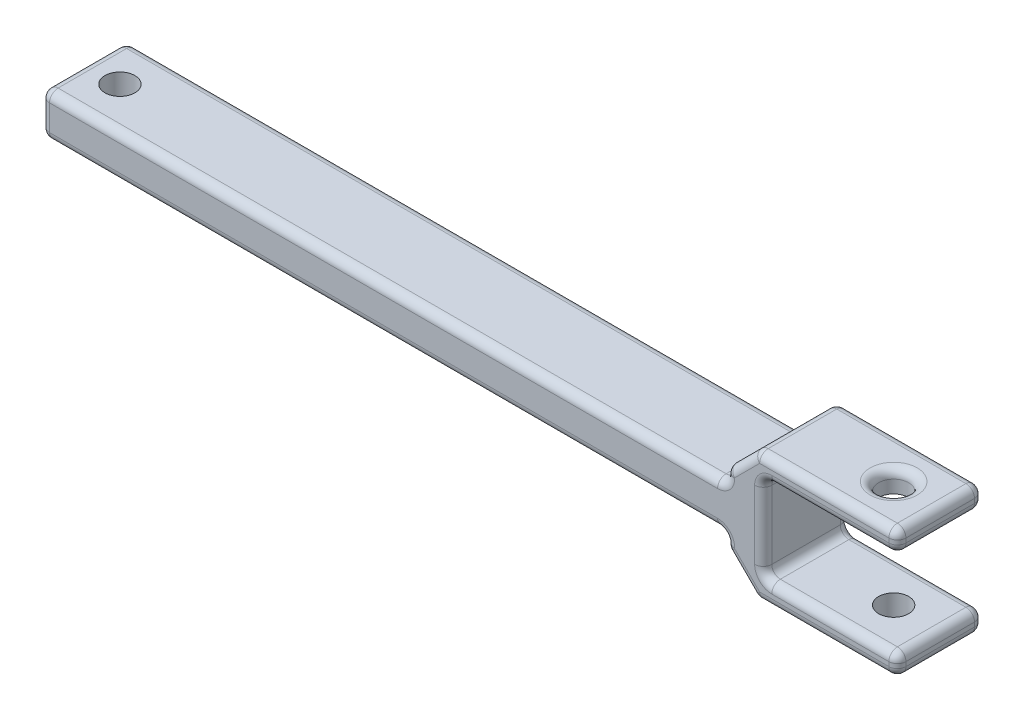
from build123d import *

# Parameters (mm, degrees)
BOSS_EXTRUDE1_DEPTH = 10
SKETCH4_W           = 15.668476733
SKETCH4_H           = 10
CUT_EXTRUDE2_DEPTH  = 121.764706338
CHAMFER2_SIZE       = 3.5
FILLET3_R           = 1
SKETCH6_R           = 1.75
CUT_EXTRUDE3_DEPTH  = 122.461369566
SKETCH9_R           = 1.75
CUT_EXTRUDE4_DEPTH  = 121.945708055
FILLET1_R           = 1


with BuildPart() as part:
    # Sketch1 → Boss-Extrude1 (new body)
    with BuildSketch(Plane.XY):
        Polygon((20.116045127, 2.5), (100.116045127, 2.5), (100.116045127, 7.5), (120.116045127, 7.5), (120.116045127, -7.5), (100.116045127, -7.5), (100.116045127, -2.5), (20.116045127, -2.5), align=None)
    extrude(amount=-BOSS_EXTRUDE1_DEPTH)

    # Sketch4 → Cut-Extrude2 (cut, through all)
    with BuildSketch(Plane.XY):
        with Locations((112.281806761, 0)):
            Rectangle(SKETCH4_W, SKETCH4_H)
    extrude(amount=-CUT_EXTRUDE2_DEPTH, mode=Mode.SUBTRACT)

    # Chamfer2
    chamfer2_edges = [part.edges().sort_by_distance(p)[0] for p in [
        (100.116045127, 7.5, -5),
        (100.116045127, -7.5, -5),
    ]]
    chamfer(chamfer2_edges, length=CHAMFER2_SIZE)

    # Fillet3
    fillet3_edges = [part.edges().sort_by_distance(p)[0] for p in [
        (100.116045127, -3.25, -10),
        (60.116045127, -2.5, 0),
        (20.116045127, 0, 0),
        (20.116045127, 2.5, -5),
        (100.116045127, 2.5, -5),
        (120.116045127, 7.5, -5),
        (120.116045127, -7.5, -5),
        (100.116045127, -2.5, -5),
        (20.116045127, -2.5, -5),
        (120.116045127, -6.25, -10),
        (111.866045127, 7.5, -10),
        (120.116045127, 6.25, 0),
        (60.116045127, 2.5, -10),
        (120.116045127, 6.25, -10),
        (120.116045127, 5, -5),
        (112.281806761, -5, -10),
        (120.116045127, -5, -5),
        (104.447568394, 0, -10),
        (104.447568394, -5, -5),
        (112.281806761, 5, -10),
        (104.447568394, 5, -5),
        (112.281806761, 5, 0),
        (104.447568394, 0, 0),
        (112.281806761, -5, 0),
        (100.116045127, -4, -5),
        (20.116045127, 0, -10),
        (100.116045127, 3.25, 0),
        (111.866045127, -7.5, 0),
        (101.866045127, 5.75, 0),
        (101.866045127, -5.75, 0),
        (111.866045127, -7.5, -10),
        (103.616045127, -7.5, -5),
        (100.116045127, 3.25, -10),
        (101.866045127, 5.75, -10),
        (101.866045127, -5.75, -10),
        (103.616045127, 7.5, -5),
        (100.116045127, 4, -5),
        (60.116045127, -2.5, -10),
        (60.116045127, 2.5, 0),
        (111.866045127, 7.5, 0),
        (120.116045127, -6.25, 0),
        (100.116045127, -3.25, 0),
    ]]
    fillet(fillet3_edges, radius=FILLET3_R)

    # Sketch6 → Cut-Extrude3 (cut, through all)
    with BuildSketch(Plane(origin=(0, 7.5, 0), x_dir=(1, 0, 0), z_dir=(0, 1, 0))):
        with Locations(Location((114.68009223, 5, 0), (0, 0, 180))):
            Circle(SKETCH6_R)
    extrude(amount=-CUT_EXTRUDE3_DEPTH, mode=Mode.SUBTRACT)

    # Sketch9 → Cut-Extrude4 (cut, through all)
    with BuildSketch(Plane(origin=(0, 2.5, 0), x_dir=(1, 0, 0), z_dir=(0, 1, 0))):
        with Locations(Location((24.336843368, 5, 0), (0, 0, 270))):
            Circle(SKETCH9_R)
    extrude(amount=-CUT_EXTRUDE4_DEPTH, mode=Mode.SUBTRACT)

    # Fillet1
    fillet1_edges = [part.edges().sort_by_distance(p)[0] for p in [
        (116.43009223, 7.5, -5),
    ]]
    fillet(fillet1_edges, radius=FILLET1_R)


solid = part.part
